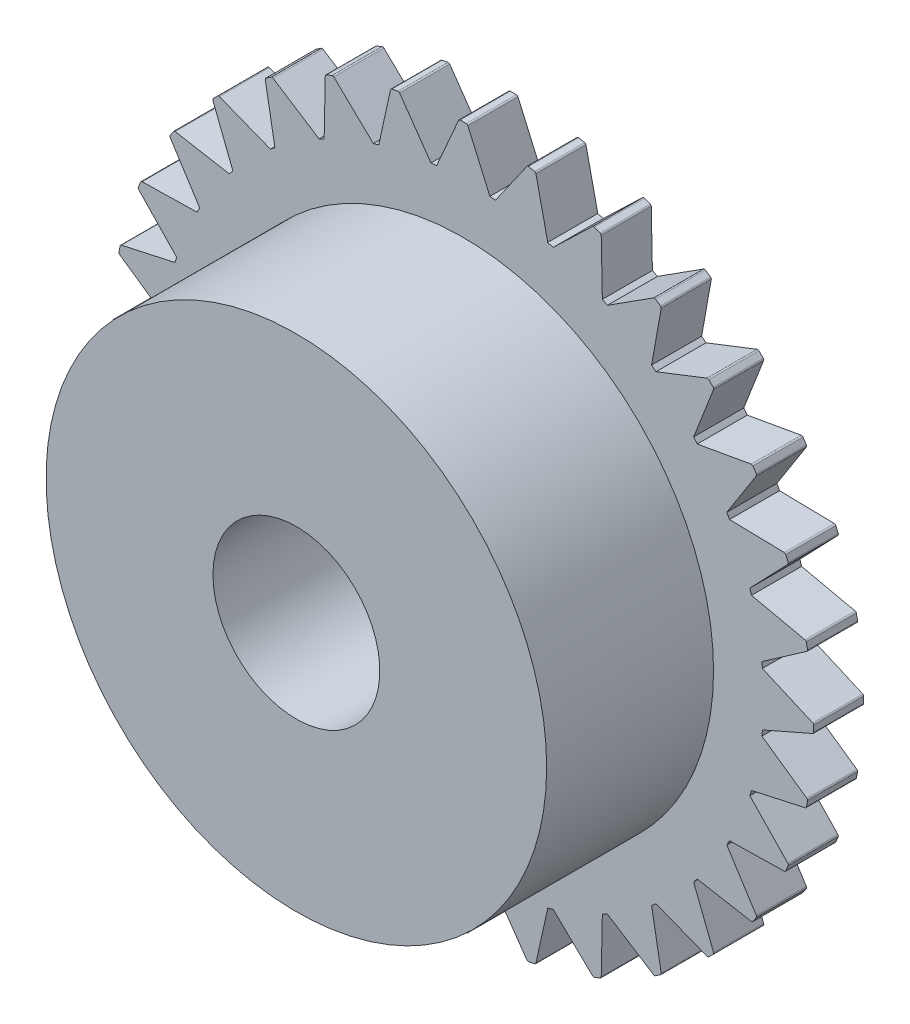
from build123d import *

# Parameters (mm, degrees)
SKETCH1_R               = 18
BOSS_EXTRUDE1_DEPTH     = 3
BOSS_EXTRUDE2_DEPTH     = 3
SKETCH3_R               = 15
BOSS_EXTRUDE3_DEPTH     = 10
CUT_EXTRUDE1_DEPTH      = 31.56141358
CUT_EXTRUDE1_DEPTH_BACK = 31.56141358
SKETCH4_R               = 5
CIRPATTERN2_COUNT       = 32


with BuildPart() as part:
    # Sketch1 → Boss-Extrude1 (new body)
    with BuildSketch(Plane.XY):
        Circle(SKETCH1_R)
    extrude(amount=BOSS_EXTRUDE1_DEPTH)

    # Sketch2 → Boss-Extrude2 (add)
    with BuildSketch(Plane.XY.offset(3)):
        with BuildLine():
            Line((-0.27622976, 20.940127536), (-1.75, 17.576076318))
            Line((-1.75, 17.576076318), (1.75, 17.576076318))
            Line((1.75, 17.576076318), (0.27622976, 20.940127536))
            ThreePointArc((0.27622976, 20.940127536), (0.239348026, 20.983704103), (0.184634013, 21))
            Line((0.184634013, 21), (-0.184634013, 21))
            ThreePointArc((-0.184634013, 21), (-0.239348026, 20.983704103), (-0.27622976, 20.940127536))
        make_face()
    boss_extrude2 = extrude(amount=-BOSS_EXTRUDE2_DEPTH)

    # Sketch3 → Boss-Extrude3 (add)
    with BuildSketch(Plane.XY.offset(3)):
        Circle(SKETCH3_R)
    extrude(amount=BOSS_EXTRUDE3_DEPTH)

    # Sketch4 → Cut-Extrude1 (cut, two sides: drawn at the far end of the back side and taken through both)
    with BuildSketch(Plane(origin=(0, 0, 0), x_dir=(-1, 0, 0), z_dir=(0, 0, -1)).offset(-CUT_EXTRUDE1_DEPTH_BACK)):
        Circle(SKETCH4_R)
    extrude(amount=CUT_EXTRUDE1_DEPTH + CUT_EXTRUDE1_DEPTH_BACK, mode=Mode.SUBTRACT)

    # CirPattern2: Boss-Extrude2 ×32 about axis
    cirpattern2_axis = Axis((0, 0, 0), (0, 0, 1))
    for i in range(1, CIRPATTERN2_COUNT):
        add(boss_extrude2.rotate(cirpattern2_axis, i * 360 / CIRPATTERN2_COUNT))


solid = part.part
